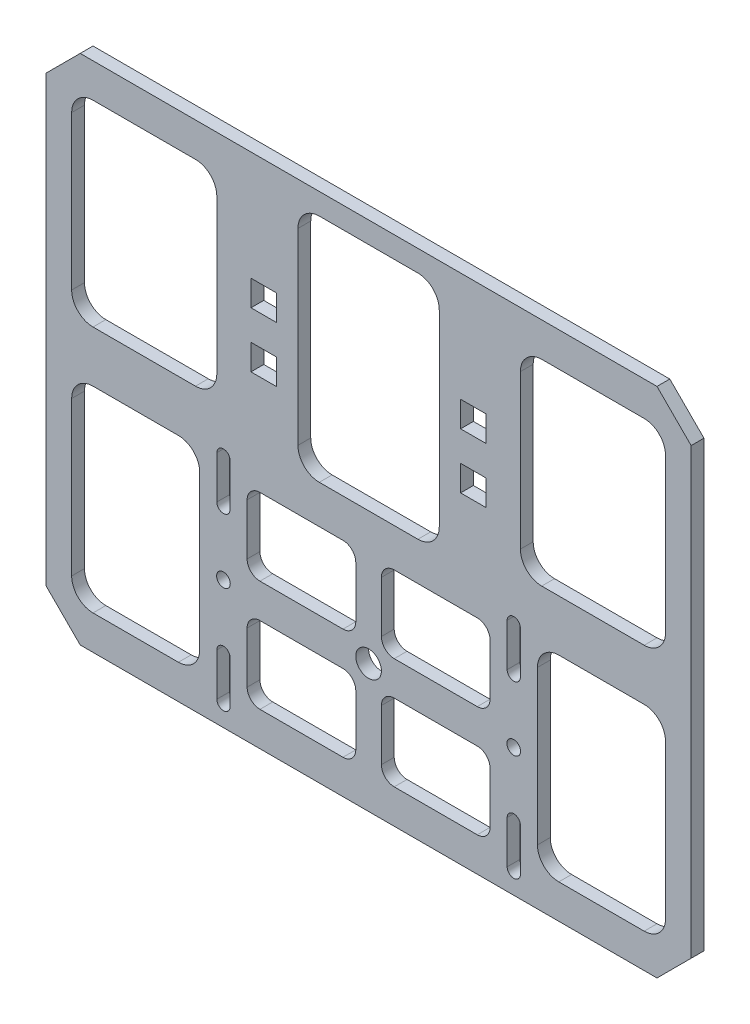
from build123d import *

# Parameters (mm, degrees)
SKETCH_1_W          = 151.1
SKETCH_1_H          = 60
SKETCH_1_R          = 3
SKETCH_1_R_2        = 1.6
SKETCH_1_W_2        = 3.1
SKETCH_1_H_2        = 10
EXTRUDE_1_DEPTH     = 3
SKETCH_2_R          = 1.55
SKETCH_2_W          = 25.45
SKETCH_2_H          = 18
CUT_EXTRUDE_1_DEPTH = 82.343730551
FILLET_1_R          = 3
SKETCH_3_W          = 151.1
SKETCH_3_H          = 60
SKETCH_3_W_2        = 6
SKETCH_3_H_2        = 6
SKETCH_3_W_3        = 33.1
SKETCH_3_H_3        = 54
EXTRUDE_2_DEPTH     = 3
SKETCH_4_W          = 34
SKETCH_4_H          = 46
SKETCH_4_W_2        = 30
CUT_EXTRUDE_2_DEPTH = 118.544895678
FILLET_2_R          = 5
CHAMFER_1_SIZE      = 8


with BuildPart() as part:
    # 草图1 → 凸台-拉伸1 (new body)
    with BuildSketch(Plane.XY):
        Rectangle(SKETCH_1_W, SKETCH_1_H)
        Circle(SKETCH_1_R, mode=Mode.SUBTRACT)
        with Locations((34, 0)):
            Circle(SKETCH_1_R_2, mode=Mode.SUBTRACT)
        with Locations((-34, 0)):
            Circle(SKETCH_1_R_2, mode=Mode.SUBTRACT)
        with Locations((34, -20)):
            Rectangle(SKETCH_1_W_2, SKETCH_1_H_2, mode=Mode.SUBTRACT)
        with Locations((-34, 20)):
            Rectangle(SKETCH_1_W_2, SKETCH_1_H_2, mode=Mode.SUBTRACT)
        with Locations((-34, -20)):
            Rectangle(SKETCH_1_W_2, SKETCH_1_H_2, mode=Mode.SUBTRACT)
        with Locations((34, 20)):
            Rectangle(SKETCH_1_W_2, SKETCH_1_H_2, mode=Mode.SUBTRACT)
    extrude(amount=EXTRUDE_1_DEPTH)

    # 草图2 → 切除-拉伸1 (cut, through all)
    with BuildSketch(Plane.XY.offset(3)):
        with Locations((-34, 25)):
            Circle(SKETCH_2_R)
        with Locations((-34, 15)):
            Circle(SKETCH_2_R)
        with Locations((34, 25)):
            Circle(SKETCH_2_R)
        with Locations((34, 15)):
            Circle(SKETCH_2_R)
        with Locations((34, -15)):
            Circle(SKETCH_2_R)
        with Locations((34, -25)):
            Circle(SKETCH_2_R)
        with Locations((-34, -15)):
            Circle(SKETCH_2_R)
        with Locations((-34, -25)):
            Circle(SKETCH_2_R)
        with Locations((-15.725, 13)):
            Rectangle(SKETCH_2_W, SKETCH_2_H)
        with Locations((15.725, 13)):
            Rectangle(SKETCH_2_W, SKETCH_2_H)
        with Locations((-15.725, -13)):
            Rectangle(SKETCH_2_W, SKETCH_2_H)
        with Locations((15.725, -13)):
            Rectangle(SKETCH_2_W, SKETCH_2_H)
    extrude(amount=-CUT_EXTRUDE_1_DEPTH, mode=Mode.SUBTRACT)

    # 圆角1
    fillet_1_edges = [part.edges().sort_by_distance(p)[0] for p in [
        (28.45, 4, 1.5),
        (3, 4, 1.5),
        (3, 22, 1.5),
        (28.45, 22, 1.5),
        (-28.45, -22, 1.5),
        (-28.45, -4, 1.5),
        (-3, -4, 1.5),
        (-3, -22, 1.5),
        (28.45, -22, 1.5),
        (3, -22, 1.5),
        (3, -4, 1.5),
        (28.45, -4, 1.5),
        (-28.45, 4, 1.5),
        (-28.45, 22, 1.5),
        (-3, 22, 1.5),
        (-3, 4, 1.5),
    ]]
    fillet(fillet_1_edges, radius=FILLET_1_R)

    # 草图3 → 凸台-拉伸2 (add)
    with BuildSketch(Plane.XY.offset(3)):
        with Locations((0, 60)):
            Rectangle(SKETCH_3_W, SKETCH_3_H)
        with Locations((24.55, 48.4)):
            Rectangle(SKETCH_3_W_2, SKETCH_3_H_2, mode=Mode.SUBTRACT)
        with Locations((-24.55, 61.4)):
            Rectangle(SKETCH_3_W_2, SKETCH_3_H_2, mode=Mode.SUBTRACT)
        with Locations((-24.55, 48.4)):
            Rectangle(SKETCH_3_W_2, SKETCH_3_H_2, mode=Mode.SUBTRACT)
        with Locations((24.55, 61.4)):
            Rectangle(SKETCH_3_W_2, SKETCH_3_H_2, mode=Mode.SUBTRACT)
        with Locations((0, 58)):
            Rectangle(SKETCH_3_W_3, SKETCH_3_H_3, mode=Mode.SUBTRACT)
    extrude(amount=-EXTRUDE_2_DEPTH)

    # 草图4 → 切除-拉伸2 (cut, through all)
    with BuildSketch(Plane.XY.offset(3)):
        with Locations((-52.55, 59)):
            Rectangle(SKETCH_4_W, SKETCH_4_H)
        with Locations((-54.55, 1)):
            Rectangle(SKETCH_4_W_2, SKETCH_4_H)
        with Locations((54.55, 1)):
            Rectangle(SKETCH_4_W_2, SKETCH_4_H)
        with Locations((52.55, 59)):
            Rectangle(SKETCH_4_W, SKETCH_4_H)
    extrude(amount=-CUT_EXTRUDE_2_DEPTH, mode=Mode.SUBTRACT)

    # 圆角2
    fillet_2_edges = [part.edges().sort_by_distance(p)[0] for p in [
        (-16.55, 85, 1.5),
        (16.55, 85, 1.5),
        (16.55, 31, 1.5),
        (-16.55, 31, 1.5),
        (69.55, 82, 1.5),
        (69.55, 36, 1.5),
        (35.55, 36, 1.5),
        (35.55, 82, 1.5),
        (69.55, 24, 1.5),
        (69.55, -22, 1.5),
        (39.55, -22, 1.5),
        (39.55, 24, 1.5),
        (-69.55, -22, 1.5),
        (-69.55, 24, 1.5),
        (-39.55, 24, 1.5),
        (-39.55, -22, 1.5),
        (-69.55, 36, 1.5),
        (-69.55, 82, 1.5),
        (-35.55, 82, 1.5),
        (-35.55, 36, 1.5),
    ]]
    fillet(fillet_2_edges, radius=FILLET_2_R)

    # 倒角1
    chamfer_1_edges = [part.edges().sort_by_distance(p)[0] for p in [
        (-75.55, 90, 1.5),
        (75.55, 90, 1.5),
        (75.55, -30, 1.5),
        (-75.55, -30, 1.5),
    ]]
    chamfer(chamfer_1_edges, length=CHAMFER_1_SIZE)


solid = part.part
